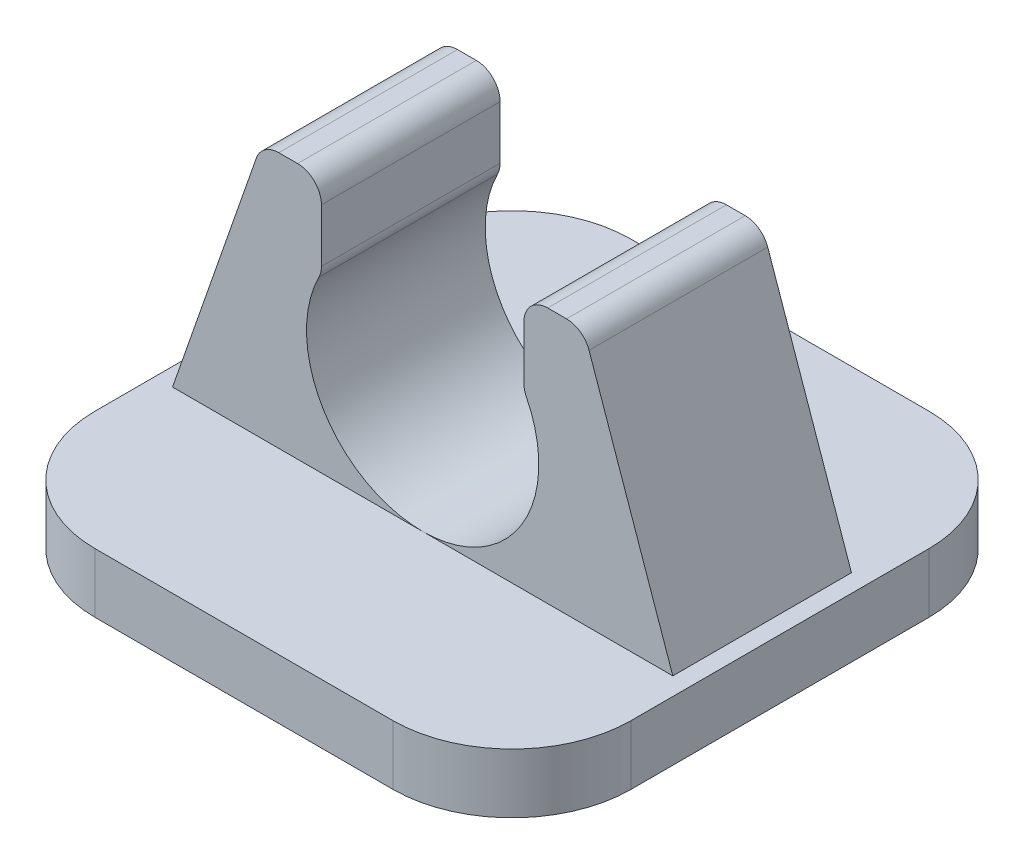
from build123d import *

# Parameters (mm, degrees)
SKETCH1_W           = 9
SKETCH1_H           = 9
BOSS_EXTRUDE1_DEPTH = 1
BOSS_EXTRUDE2_DEPTH = 3
FILLET1_R           = 0.4
FILLET2_R           = 2


with BuildPart() as part:
    # Sketch1 → Boss-Extrude1 (new body)
    with BuildSketch(Plane(origin=(0, 0, 0), x_dir=(1, 0, 0), z_dir=(0, 1, 0))):
        Rectangle(SKETCH1_W, SKETCH1_H)
    extrude(amount=BOSS_EXTRUDE1_DEPTH)

    # Sketch2 → Boss-Extrude2 (add)
    with BuildSketch(Plane.XY.offset(1.5)):
        with BuildLine():
            ThreePointArc((0, 1), (-1.683038158, 1.965173844), (-1.7, 3.905248659))
            Line((-1.7, 3.905248659), (-1.7, 5.3))
            Line((-1.7, 5.3), (-2.7, 5.3))
            Line((-2.7, 5.3), (-4.2, 1))
            Line((-4.2, 1), (0, 1))
        make_face()
        with BuildLine():
            Line((1.7, 5.3), (1.7, 3.905248659))
            ThreePointArc((1.7, 3.905248659), (1.886464948, 3.443710441), (1.95, 2.95))
            ThreePointArc((1.95, 2.95), (1.378858223, 1.571141777), (0, 1))
            Line((0, 1), (4.2, 1))
            Line((4.2, 1), (2.7, 5.3))
            Line((2.7, 5.3), (1.7, 5.3))
        make_face()
    extrude(amount=-BOSS_EXTRUDE2_DEPTH)

    # Fillet1
    fillet1_edges = [part.edges().sort_by_distance(p)[0] for p in [
        (-1.7, 3.905248659, 0),
        (-2.7, 5.3, 0),
        (-1.7, 5.3, 0),
        (1.7, 3.905248659, 0),
        (1.7, 5.3, 0),
        (2.7, 5.3, 0),
    ]]
    fillet(fillet1_edges, radius=FILLET1_R)

    # Fillet2
    fillet2_edges = [part.edges().sort_by_distance(p)[0] for p in [
        (4.5, 0.5, 4.5),
        (-4.5, 0.5, 4.5),
        (-4.5, 0.5, -4.5),
        (4.5, 0.5, -4.5),
    ]]
    fillet(fillet2_edges, radius=FILLET2_R)


solid = part.part
